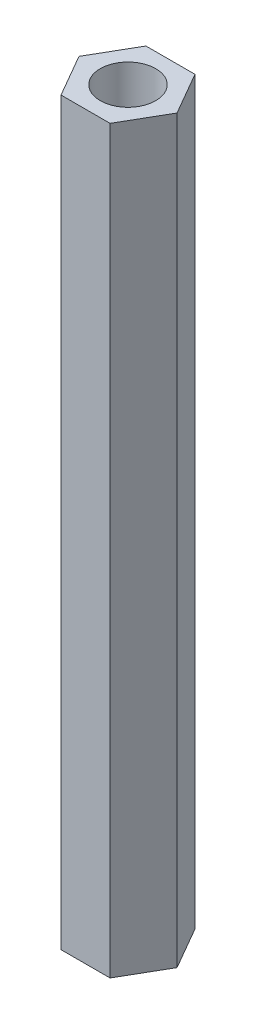
from build123d import *

# Parameters (mm, degrees)
EXTRUDE_1_DEPTH     = 40
SKETCH_3_R          = 1.5
CUT_EXTRUDE_1_DEPTH = 40


with BuildPart() as part:
    # 草图1 → 凸台-拉伸1 (new body)
    with BuildSketch(Plane(origin=(0, 0, 0), x_dir=(1, 0, 0), z_dir=(0, 1, 0))):
        Polygon((2.650037736, 0), (1.325018868, 2.295), (-1.325018868, 2.295), (-2.650037736, 0), (-1.325018868, -2.295), (1.325018868, -2.295), align=None)
    extrude(amount=EXTRUDE_1_DEPTH)

    # 草图3 → 切除-拉伸1 (cut)
    with BuildSketch(Plane(origin=(0, 40, 0), x_dir=(1, 0, 0), z_dir=(0, 1, 0))):
        with Locations(Location((0, 0, 0), (0, 0, 270))):
            Circle(SKETCH_3_R)
    extrude(amount=-CUT_EXTRUDE_1_DEPTH, mode=Mode.SUBTRACT)


solid = part.part
